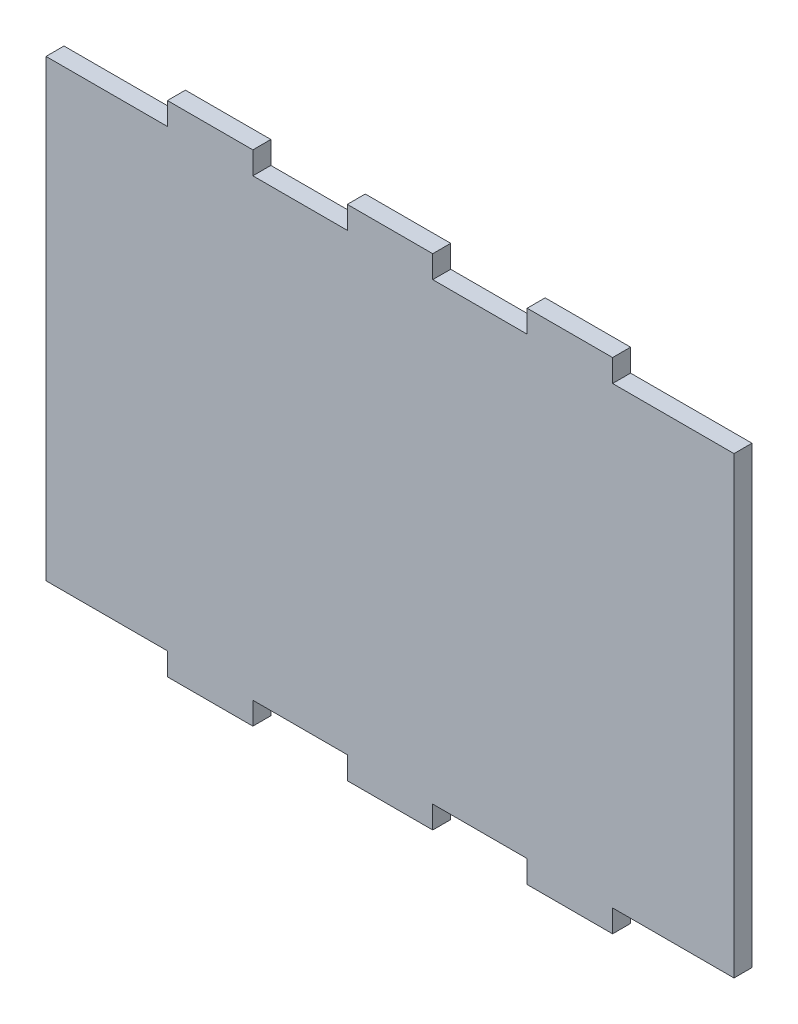
from build123d import *

# Parameters (mm, degrees)
BOSS_EXTRU_1_DEPTH = 2


with BuildPart() as part:
    # Esquisse1 → Boss.-Extru.1 (new body)
    with BuildSketch(Plane.XY):
        Polygon((-15.25, 25.25), (-4.75, 25.25), (-4.75, 27.75), (4.75, 27.75), (4.75, 25.25), (15.25, 25.25), (15.25, 27.75), (24.75, 27.75), (24.75, 25.25), (38.25, 25.25), (38.25, -25.25), (24.75, -25.25), (24.75, -27.75), (15.25, -27.75), (15.25, -25.25), (4.75, -25.25), (4.75, -27.75), (-4.75, -27.75), (-4.75, -25.25), (-15.25, -25.25), (-15.25, -27.75), (-24.75, -27.75), (-24.75, -25.25), (-38.25, -25.25), (-38.25, 25.25), (-24.75, 25.25), (-24.75, 27.75), (-15.25, 27.75), align=None)
    extrude(amount=BOSS_EXTRU_1_DEPTH)


solid = part.part
